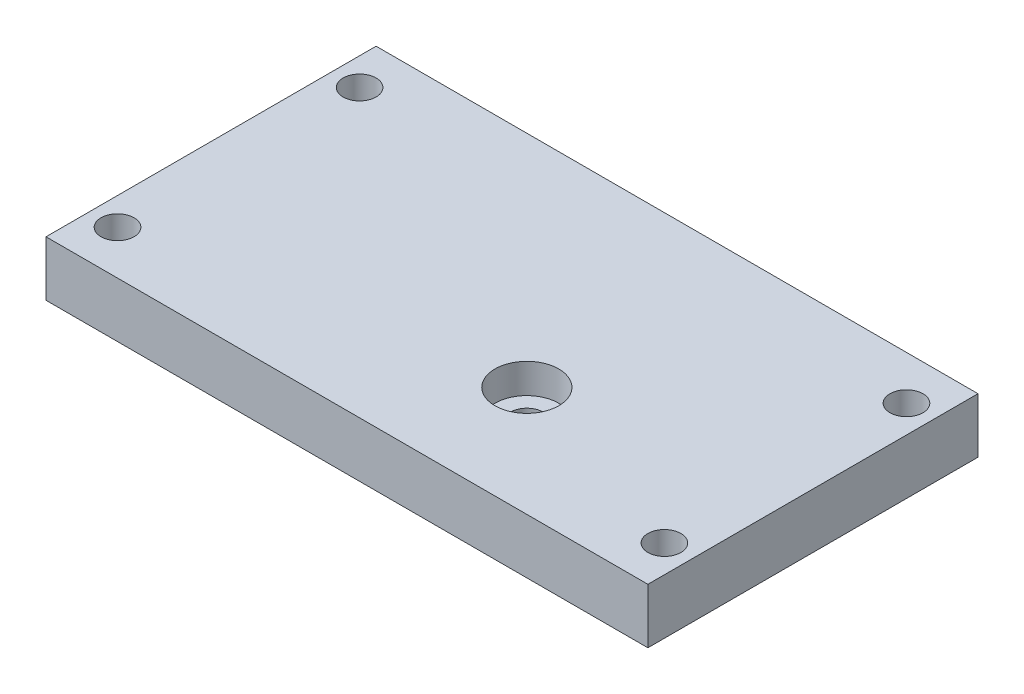
from build123d import *

# Parameters (mm, degrees)
ESQUISSE1_W             = 54.7
ESQUISSE1_H             = 30
EXTRUSION1_DEPTH        = 5
ESQUISSE2_R             = 1.5
ENL_V_MAT_EXTRU_1_DEPTH = 54.806040553
ESQUISSE3_R             = 2.9
ENL_V_MAT_EXTRU_2_DEPTH = 54.641215497
ESQUISSE4_R             = 1.5
ENL_V_MAT_EXTRU_3_DEPTH = 54.806040553


with BuildPart() as part:
    # Esquisse1 → Extrusion1 (new body)
    with BuildSketch(Plane(origin=(0, 0, 0), x_dir=(1, 0, 0), z_dir=(0, 1, 0))):
        with Locations((-22.35, 5)):
            Rectangle(ESQUISSE1_W, ESQUISSE1_H)
    extrude(amount=EXTRUSION1_DEPTH)

    # Esquisse2 → Enlèv. mat.-Extru.1 (cut, through all)
    with BuildSketch(Plane(origin=(0, 5, 0), x_dir=(1, 0, 0), z_dir=(0, 1, 0))):
        with Locations(Location((-16, 0, 0), (0, 0, 270))):
            Circle(ESQUISSE2_R)
    extrude(amount=-ENL_V_MAT_EXTRU_1_DEPTH, mode=Mode.SUBTRACT)

    # Esquisse3 → Enlèv. mat.-Extru.2 (cut, through all)
    with BuildSketch(Plane.XZ.offset(-2.3)):
        with Locations((-16, 0)):
            Circle(ESQUISSE3_R)
    extrude(amount=-ENL_V_MAT_EXTRU_2_DEPTH, mode=Mode.SUBTRACT)

    # Esquisse4 → Enlèv. mat.-Extru.3 (cut, through all)
    with BuildSketch(Plane(origin=(0, 5, 0), x_dir=(1, 0, 0), z_dir=(0, 1, 0))):
        with Locations(Location((2.5, -6, 0), (0, 0, 270))):
            Circle(ESQUISSE4_R)
        with Locations(Location((2.5, 16, 0), (0, 0, 270))):
            Circle(ESQUISSE4_R)
        with Locations(Location((-47.2, 16, 0), (0, 0, 270))):
            Circle(ESQUISSE4_R)
        with Locations(Location((-47.2, -6, 0), (0, 0, 270))):
            Circle(ESQUISSE4_R)
    extrude(amount=-ENL_V_MAT_EXTRU_3_DEPTH, mode=Mode.SUBTRACT)


solid = part.part
